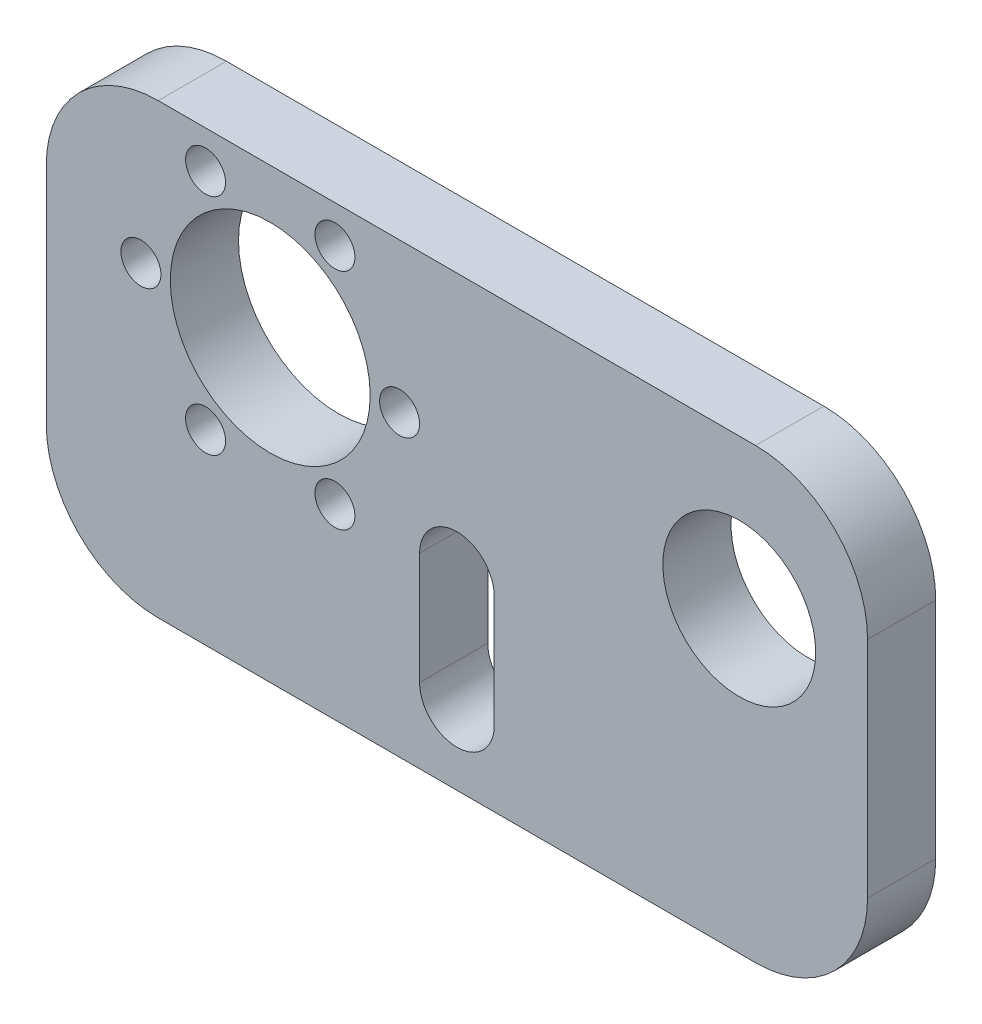
from build123d import *

# Parameters (mm, degrees)
SKETCH1_W            = 69.85
SKETCH1_H            = 38.1
SKETCH1_R            = 6.5
SKETCH1_R_2          = 8.5
BOSS_EXTRUDE1_DEPTH  = 5.8
M3_CLEARANCE_HOLE1_D = 3.4
CUT_EXTRUDE1_DEPTH   = 80.776390618
FILLET1_R            = 9.525


with BuildPart() as part:
    # Sketch1 → Boss-Extrude1 (new body)
    with BuildSketch(Plane.XY):
        with Locations((34.925, 19.05)):
            Rectangle(SKETCH1_W, SKETCH1_H)
        with Locations((58.939787697, 25.4)):
            Circle(SKETCH1_R, mode=Mode.SUBTRACT)
        with Locations((19.05, 25.4)):
            Circle(SKETCH1_R_2, mode=Mode.SUBTRACT)
    extrude(amount=BOSS_EXTRUDE1_DEPTH)

    # M3 Clearance Hole1 (through all)
    with Locations(Plane.XY.offset(5.8)):
        with Locations((30.05, 25.4), (24.55, 34.926279442), (13.55, 34.926279442), (8.05, 25.4), (13.55, 15.873720558), (24.55, 15.873720558)):
            Hole(M3_CLEARANCE_HOLE1_D / 2)

    # Sketch3 → Cut-Extrude1 (cut, through all)
    with BuildSketch(Plane.XY.offset(5.8)):
        with BuildLine():
            Line((31.75, 15.875), (31.75, 6.35))
            ThreePointArc((31.75, 6.35), (34.925, 3.175), (38.1, 6.35))
            Line((38.1, 6.35), (38.1, 15.875))
            ThreePointArc((38.1, 15.875), (34.925, 19.05), (31.75, 15.875))
        make_face()
    extrude(amount=-CUT_EXTRUDE1_DEPTH, mode=Mode.SUBTRACT)

    # Fillet1
    fillet1_edges = [part.edges().sort_by_distance(p)[0] for p in [
        (0, 0, 2.9),
        (0, 38.1, 2.9),
        (69.85, 38.1, 2.9),
        (69.85, 0, 2.9),
    ]]
    fillet(fillet1_edges, radius=FILLET1_R)


solid = part.part
